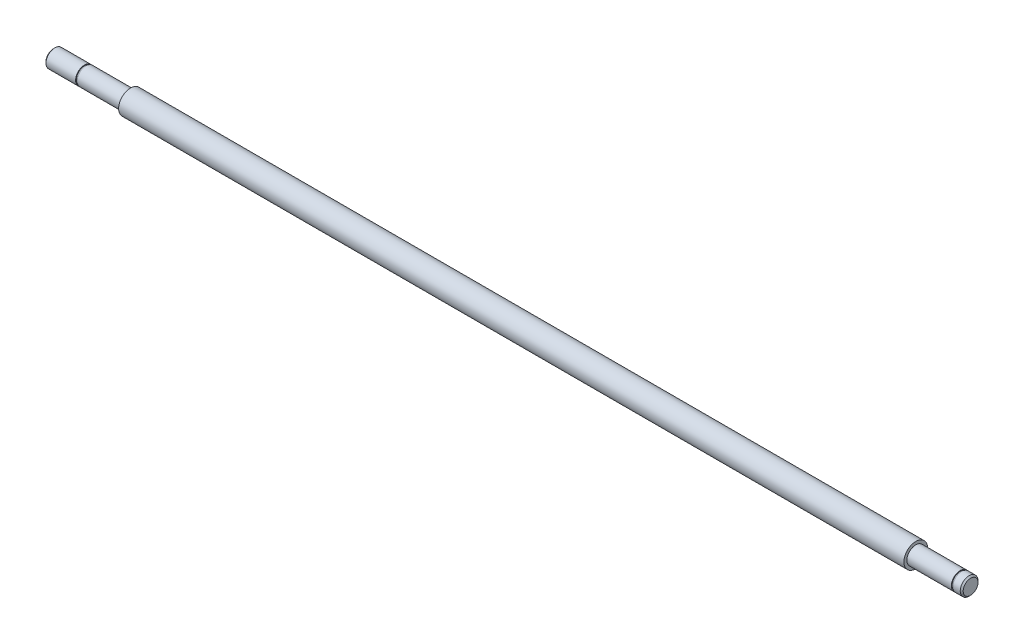
from build123d import *

# Parameters (mm, degrees)
CHAMFER_1_SIZE = 0.5


with BuildPart() as part:
    # 草图1 → 旋转1 (revolve)
    with BuildSketch(Plane.XY, mode=Mode.PRIVATE) as revolve_1_sk:
        Polygon((-132.5, 4), (132.5, 4), (132.5, 3), (147.5, 3), (147.5, 2.75), (148, 2.75), (148, 3), (151, 3), (151, 0), (-158.5, 0), (-158.5, 3), (-148, 3), (-148, 2.75), (-147.5, 2.75), (-147.5, 3), (-132.5, 3), align=None)
    revolve(revolve_1_sk.sketch.rotate(Axis((0, 0, 0), (1, 0, 0)), 90), axis=Axis((0, 0, 0), (1, 0, 0)))

    # 倒角1
    chamfer_1_edges = [part.edges().sort_by_distance(p)[0] for p in [
        (151, 0, -3),
        (-158.5, 0, -3),
    ]]
    chamfer(chamfer_1_edges, length=CHAMFER_1_SIZE)


solid = part.part
